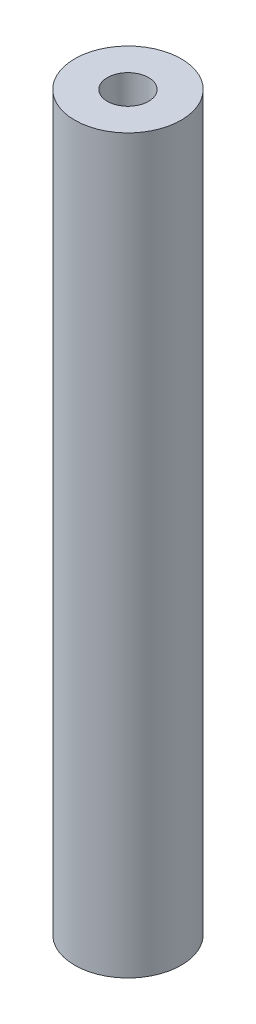
from build123d import *

# Parameters (mm, degrees)
SKIZZE1_R                       = 4
AUFSATZ_LINEAR_AUSTRAGEN1_DEPTH = 55
SKIZZE2_R                       = 1.55
SCHNITT_LINEAR_AUSTRAGEN1_DEPTH = 10
SKIZZE3_R                       = 1.65
SCHNITT_LINEAR_AUSTRAGEN2_DEPTH = 10


with BuildPart() as part:
    # Skizze1 → Aufsatz-Linear austragen1 (new body)
    with BuildSketch(Plane(origin=(0, 0, 0), x_dir=(1, 0, 0), z_dir=(0, 1, 0))):
        with Locations(Location((0, 0, 0), (0, 0, 270))):
            Circle(SKIZZE1_R)
    extrude(amount=AUFSATZ_LINEAR_AUSTRAGEN1_DEPTH)

    # Skizze2 → Schnitt-Linear austragen1 (cut)
    with BuildSketch(Plane(origin=(0, 55, 0), x_dir=(1, 0, 0), z_dir=(0, 1, 0))):
        with Locations(Location((0, 0, 0), (0, 0, 270))):
            Circle(SKIZZE2_R)
    extrude(amount=-SCHNITT_LINEAR_AUSTRAGEN1_DEPTH, mode=Mode.SUBTRACT)

    # Skizze3 → Schnitt-Linear austragen2 (cut)
    with BuildSketch(Plane.XZ):
        with Locations(Location((0, 0, 0), (0, 0, 270))):
            Circle(SKIZZE3_R)
    extrude(amount=-SCHNITT_LINEAR_AUSTRAGEN2_DEPTH, mode=Mode.SUBTRACT)


solid = part.part
